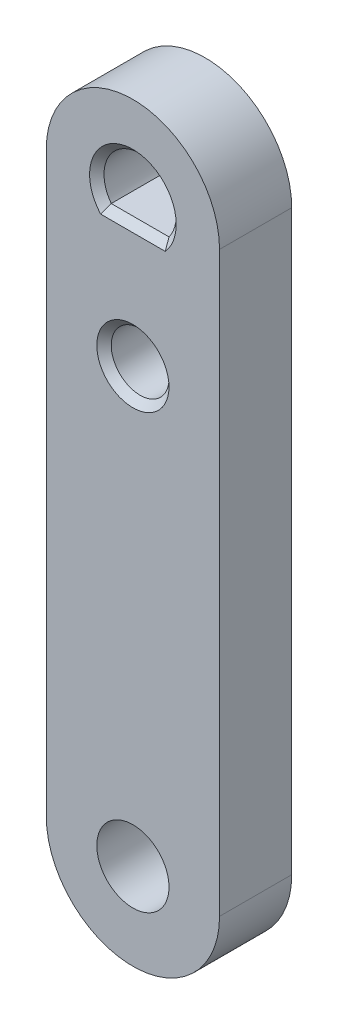
from build123d import *

# Parameters (mm, degrees)
SZKIC1_R                    = 2.5
SZKIC1_R_2                  = 2
DODANIE_WYCI_GNI_CIE1_DEPTH = 5
SFAZOWANIE1_SIZE            = 0.5


with BuildPart() as part:
    # Szkic1 → Dodanie-wyciągnięcie1 (new body)
    with BuildSketch(Plane.XY):
        with BuildLine():
            Line((6, -40), (6, 0))
            ThreePointArc((6, 0), (0, 6), (-6, 0))
            Line((-6, 0), (-6, -40))
            ThreePointArc((-6, -40), (0, -46), (6, -40))
        make_face()
        with Locations((0, -40)):
            Circle(SZKIC1_R, mode=Mode.SUBTRACT)
        with Locations((0, -10)):
            Circle(SZKIC1_R_2, mode=Mode.SUBTRACT)
        with BuildLine():
            Line((-2, -1.5), (2, -1.5))
            ThreePointArc((2, -1.5), (0, 2.5), (-2, -1.5))
        make_face(mode=Mode.SUBTRACT)
    extrude(amount=DODANIE_WYCI_GNI_CIE1_DEPTH)

    # Sfazowanie1
    sfazowanie1_edges = [part.edges().sort_by_distance(p)[0] for p in [
        (0, -1.5, 0),
        (0, 2.5, 0),
        (-2, -10, 0),
        (0, 2.5, 5),
        (0, -1.5, 5),
        (-2, -10, 5),
    ]]
    chamfer(sfazowanie1_edges, length=SFAZOWANIE1_SIZE)


solid = part.part
